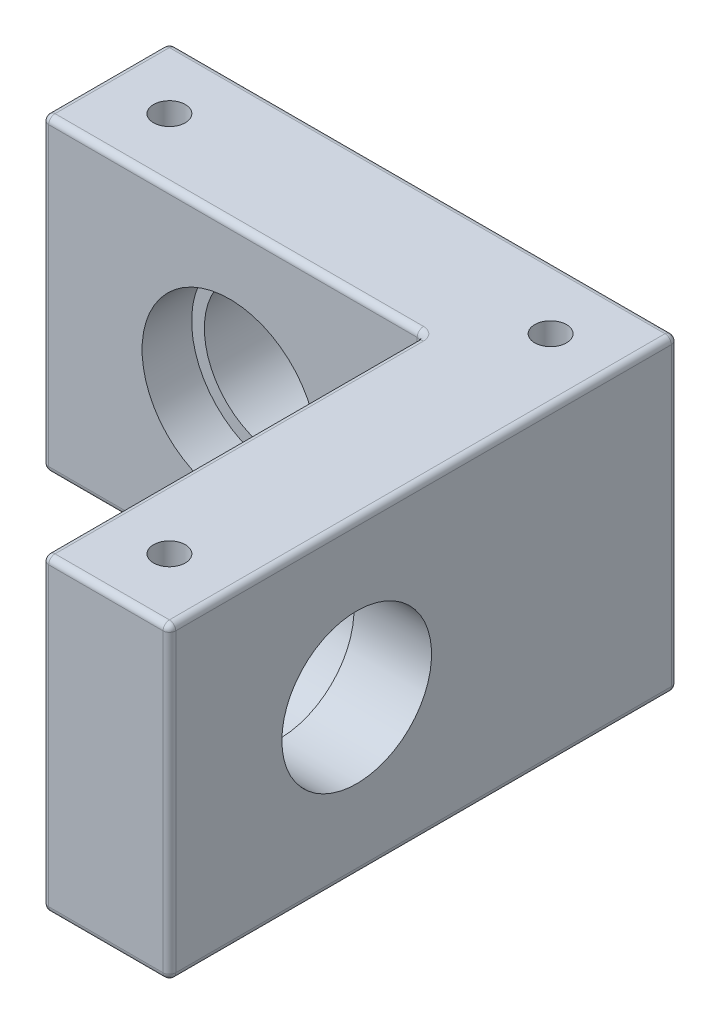
from build123d import *

# Parameters (mm, degrees)
BOSS_EXTRUDE1_DEPTH = 61.722
SKETCH3_R           = 17.5006
CUT_EXTRUDE1_DEPTH  = 9.906
SKETCH4_R           = 14.9606
CUT_EXTRUDE2_DEPTH  = 147.78694942
SKETCH5_R           = 3.175
CUT_EXTRUDE3_DEPTH  = 157.380066773
SKETCH6_R           = 17.5006
CUT_EXTRUDE4_DEPTH  = 9.906
SKETCH7_R           = 14.9606
CUT_EXTRUDE5_DEPTH  = 147.78694942
FILLET1_R           = 1.27


with BuildPart() as part:
    # Sketch2 → Boss-Extrude1 (new body)
    with BuildSketch(Plane(origin=(0, 0, 0), x_dir=(1, 0, 0), z_dir=(0, 1, 0))):
        Polygon((0, 0), (0, 101.6), (-101.6, 101.6), (-101.6, 76.2), (-25.4, 76.2), (-25.4, 0), align=None)
    extrude(amount=BOSS_EXTRUDE1_DEPTH)

    # Sketch3 → Cut-Extrude1 (cut)
    with BuildSketch(Plane.XY.offset(-76.2)):
        with Locations((-64.1604, 30.861)):
            Circle(SKETCH3_R)
    extrude(amount=-CUT_EXTRUDE1_DEPTH, mode=Mode.SUBTRACT)

    # Sketch4 → Cut-Extrude2 (cut, through all)
    with BuildSketch(Plane.XY.offset(-86.106)):
        with Locations((-64.1604, 30.861)):
            Circle(SKETCH4_R)
    extrude(amount=-CUT_EXTRUDE2_DEPTH, mode=Mode.SUBTRACT)

    # Sketch5 → Cut-Extrude3 (cut, through all)
    with BuildSketch(Plane(origin=(0, 61.722, 0), x_dir=(1, 0, 0), z_dir=(0, 1, 0))):
        with Locations(Location((-88.9, 88.9, 0), (0, 0, 270))):
            Circle(SKETCH5_R)
        with Locations(Location((-12.7, 88.9, 0), (0, 0, 270))):
            Circle(SKETCH5_R)
        with Locations(Location((-12.7, 12.7, 0), (0, 0, 270))):
            Circle(SKETCH5_R)
    extrude(amount=-CUT_EXTRUDE3_DEPTH, mode=Mode.SUBTRACT)

    # Sketch6 → Cut-Extrude4 (cut)
    with BuildSketch(Plane.ZY.offset(25.4)):
        with Locations((-37.4396, 30.861)):
            Circle(SKETCH6_R)
    extrude(amount=-CUT_EXTRUDE4_DEPTH, mode=Mode.SUBTRACT)

    # Sketch7 → Cut-Extrude5 (cut, through all)
    with BuildSketch(Plane.ZY.offset(15.494)):
        with Locations((-37.4396, 30.861)):
            Circle(SKETCH7_R)
    extrude(amount=-CUT_EXTRUDE5_DEPTH, mode=Mode.SUBTRACT)

    # Fillet1
    fillet1_edges = [part.edges().sort_by_distance(p)[0] for p in [
        (-25.4, 30.861, 0),
        (-25.4, 30.861, -76.2),
        (-101.6, 30.861, -76.2),
        (-101.6, 30.861, -101.6),
        (0, 30.861, -101.6),
        (0, 30.861, 0),
        (-50.8, 61.722, -101.6),
        (-101.6, 61.722, -88.9),
        (-63.5, 61.722, -76.2),
        (-25.4, 61.722, -38.1),
        (-12.7, 61.722, 0),
        (-25.4, 0, -38.1),
        (-63.5, 0, -76.2),
        (-101.6, 0, -88.9),
        (-50.8, 0, -101.6),
        (0, 0, -50.8),
        (-12.7, 0, 0),
        (0, 61.722, -50.8),
    ]]
    fillet(fillet1_edges, radius=FILLET1_R)


solid = part.part
